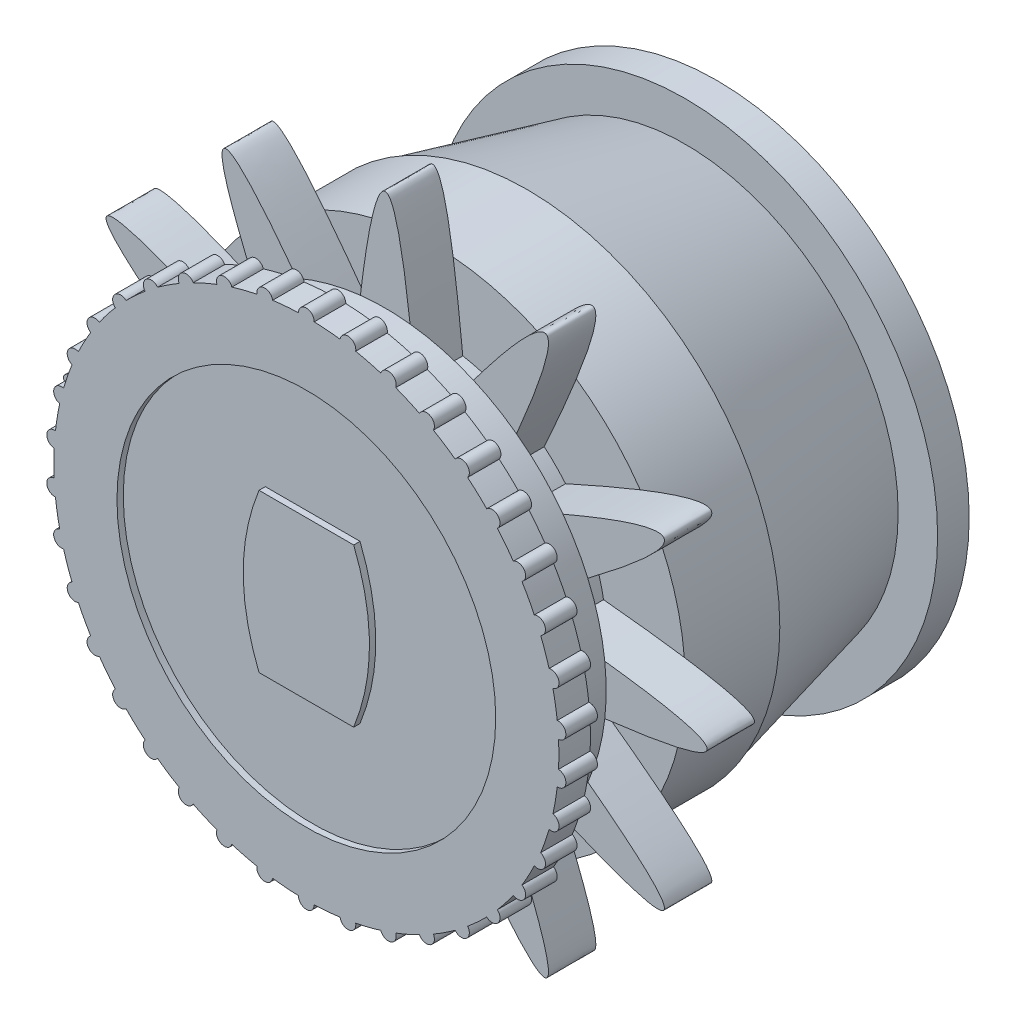
from build123d import *

# Parameters (mm, degrees)
SKETCH1_R            = 5.5
GEARPLATE_DEPTH      = 1.5
BOSS_EXTRUDE3_DEPTH  = 1.5
CIRPATTERN2_COUNT    = 12
SKETCH3_R            = 7
PLATE_DEPTH          = 1.5
SKETCH4_R            = 8
SMALLGEARPLATE_DEPTH = 1
SKETCH6_R            = 0.25
BOSS_EXTRUDE7_DEPTH  = 1
CIRPATTERN3_COUNT    = 38
SKETCH7_R            = 6
SMALLGEARCUT_DEPTH   = 0.2
BOSS_EXTRUDE9_DEPTH  = 0.2
BACKPLATE_START      = 3
SKETCH10_R           = 8
BACKPLATE_DEPTH      = 3
SKETCH11_R           = 6.75
BOSS_EXTRUDE11_DEPTH = 5
BOSS_EXTRUDE11_DRAFT = 13.7
BOSS_EXTRUDE12_START = 1
SKETCH12_R           = 8
BOSS_EXTRUDE12_DEPTH = 1


with BuildPart() as part:
    # Sketch1 → GearPlate (new body)
    with BuildSketch(Plane.XY):
        Circle(SKETCH1_R)
    extrude(amount=GEARPLATE_DEPTH)

    # Sketch2 → Boss-Extrude3 (add)
    with BuildSketch(Plane.XY.offset(1.5)):
        with BuildLine():
            Line((-0.956549584, 5.416180656), (0.956549584, 5.416180656))
            add(Edge.make_bspline(
                [(-0.956549584, 5.416180656), (0, 14.979109445), (0.956549584, 5.416180656)],
                knots=[0, 0, 0, 1, 1, 1], degree=2))
        make_face()
    boss_extrude3 = extrude(amount=-BOSS_EXTRUDE3_DEPTH)

    # CirPattern2: Boss-Extrude3 ×12 about axis
    cirpattern2_axis = Axis((0, 0, 1.5), (0, 0, -1))
    for i in range(1, CIRPATTERN2_COUNT):
        add(boss_extrude3.rotate(cirpattern2_axis, i * 360 / CIRPATTERN2_COUNT))

    # Sketch3 → Plate (add)
    with BuildSketch(Plane.XY.offset(1.5)):
        with Locations(Location((0, 0, 0), (0, 0, 186.460790626))):
            Circle(SKETCH3_R)
    extrude(amount=PLATE_DEPTH)

    # Sketch4 → SmallGearPlate (add)
    with BuildSketch(Plane.XY.offset(3)):
        Circle(SKETCH4_R)
    extrude(amount=SMALLGEARPLATE_DEPTH)

    # Sketch6 → Boss-Extrude7 (add)
    with BuildSketch(Plane.XY.offset(4)):
        with Locations((0, 8)):
            Circle(SKETCH6_R)
    boss_extrude7 = extrude(amount=-BOSS_EXTRUDE7_DEPTH)

    # CirPattern3: Boss-Extrude7 ×38 about axis
    cirpattern3_axis = Axis((0, 0, 0), (0, 0, 1))
    for i in range(1, CIRPATTERN3_COUNT):
        add(boss_extrude7.rotate(cirpattern3_axis, i * 360 / CIRPATTERN3_COUNT))

    # Sketch7 → SmallGearCut (cut)
    with BuildSketch(Plane.XY.offset(4)):
        Circle(SKETCH7_R)
    extrude(amount=-SMALLGEARCUT_DEPTH, mode=Mode.SUBTRACT)

    # Sketch8 → Boss-Extrude9 (add)
    with BuildSketch(Plane.XY.offset(3.8)):
        with BuildLine():
            Line((-1.5, -2.5), (1.5, -2.5))
            add(Edge.make_bspline(
                [(1.5, 2.5), (2.5, 0), (1.5, -2.5)],
                knots=[0, 0, 0, 1, 1, 1], degree=2))
            Line((1.5, 2.5), (-1.5, 2.5))
            add(Edge.make_bspline(
                [(-1.5, 2.5), (-2.5, 0), (-1.5, -2.5)],
                knots=[0, 0, 0, 1, 1, 1], degree=2))
        make_face()
    extrude(amount=BOSS_EXTRUDE9_DEPTH)

    # Sketch10 → BackPlate (add)
    with BuildSketch(Plane(origin=(0, 0, 0), x_dir=(-1, 0, 0), z_dir=(0, 0, -1)).offset(BACKPLATE_START)):
        with Locations(Location((0, 0, 0), (0, 0, 175.322237658))):
            Circle(SKETCH10_R)
    extrude(amount=-BACKPLATE_DEPTH)


with BuildPart() as boss_extrude11_tool:
    # Sketch11 → Boss-Extrude11 (with draft: the straight prism first)
    with BuildSketch(Plane(origin=(0, 0, -8), x_dir=(-1, 0, 0), z_dir=(0, 0, -1))):
        Circle(SKETCH11_R)
    extrude(amount=-BOSS_EXTRUDE11_DEPTH)
    # Boss-Extrude11: the draft: its side faces are tilted about the plane it starts from
    boss_extrude11_sides = [boss_extrude11_tool.faces().sort_by_distance(p)[0] for p in [
        (6.75, 0, -5.5),
    ]]
    draft(boss_extrude11_sides, Plane(origin=(0, 0, -8), x_dir=(-1, 0, 0), z_dir=(0, 0, -1)), BOSS_EXTRUDE11_DRAFT)


with BuildPart() as part_1:
    add(part.part)

    # Boss-Extrude11: add boss_extrude11_tool
    add(boss_extrude11_tool.part)

    # Sketch12 → Boss-Extrude12 (add)
    with BuildSketch(Plane(origin=(0, 0, -8), x_dir=(-1, 0, 0), z_dir=(0, 0, -1)).offset(BOSS_EXTRUDE12_START)):
        with Locations(Location((0, 0, 0), (0, 0, 175.322237658))):
            Circle(SKETCH12_R)
    extrude(amount=-BOSS_EXTRUDE12_DEPTH)


solid = part_1.part
